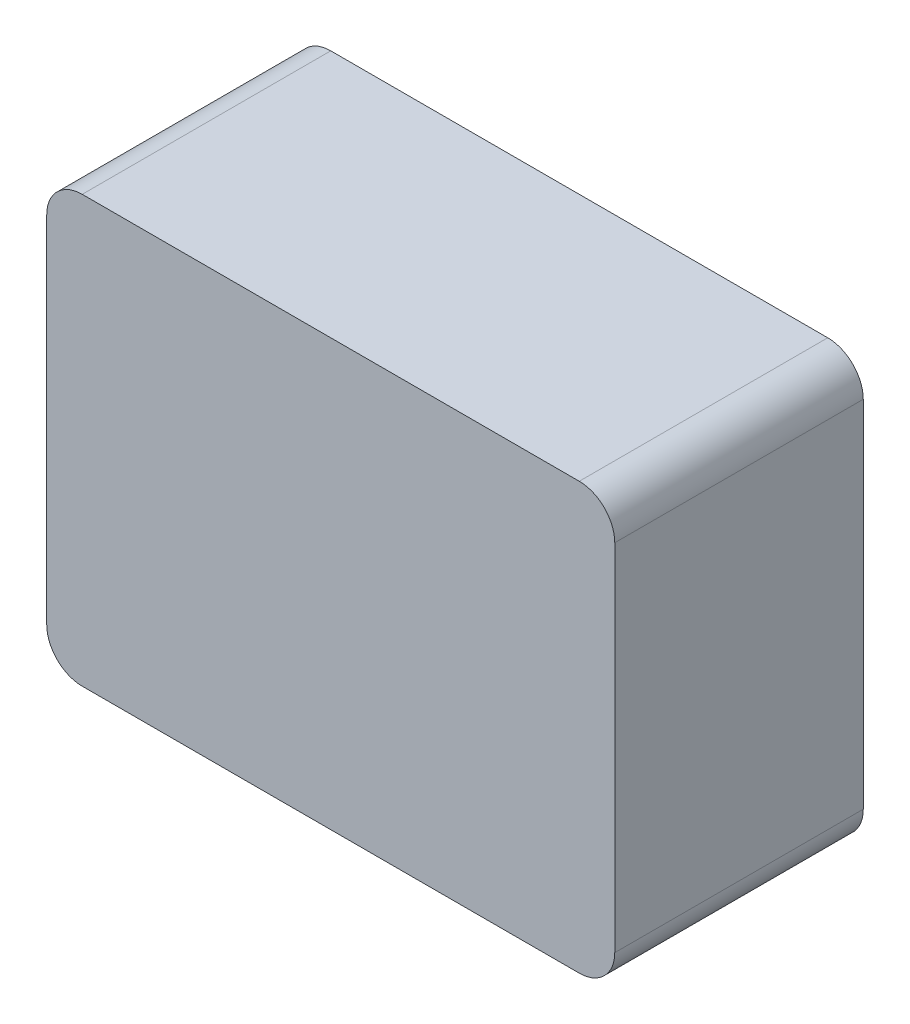
from build123d import *

# Parameters (mm, degrees)
SKETCH1_W           = 80
SKETCH1_H           = 60
BOSS_EXTRUDE5_DEPTH = 5
SKETCH4_W           = 80
SKETCH4_H           = 60
SKETCH4_W_2         = 75
SKETCH4_H_2         = 55
BOSS_EXTRUDE6_DEPTH = 30
FILLET2_R           = 5


with BuildPart() as part:
    # Sketch1 → Boss-Extrude5 (new body)
    with BuildSketch(Plane.XY):
        Rectangle(SKETCH1_W, SKETCH1_H)
    extrude(amount=-BOSS_EXTRUDE5_DEPTH)

    # Sketch4 → Boss-Extrude6 (add)
    with BuildSketch(Plane(origin=(0, 0, -5), x_dir=(-1, 0, 0), z_dir=(0, 0, -1))):
        Rectangle(SKETCH4_W, SKETCH4_H)
        Rectangle(SKETCH4_W_2, SKETCH4_H_2, mode=Mode.SUBTRACT)
    extrude(amount=BOSS_EXTRUDE6_DEPTH)

    # Fillet2
    fillet2_edges = [part.edges().sort_by_distance(p)[0] for p in [
        (40, -30, -17.5),
        (-40, -30, -17.5),
        (-40, 30, -17.5),
        (40, 30, -17.5),
    ]]
    fillet(fillet2_edges, radius=FILLET2_R)


solid = part.part
